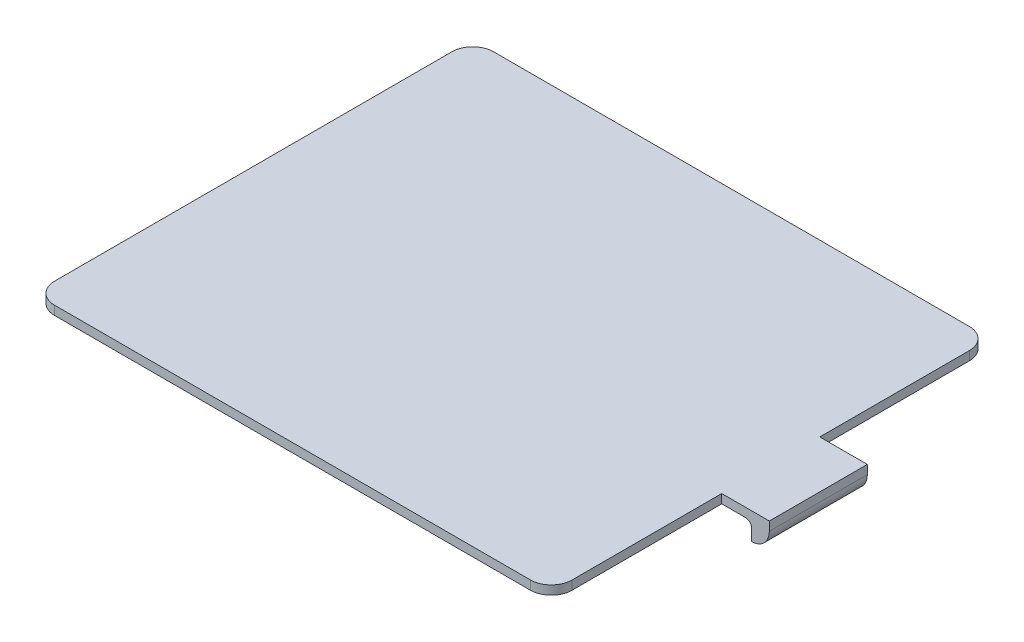
from build123d import *

# Parameters (mm, degrees)
BOSS_EXTRUDE1_DEPTH = 1.5
SKETCH3_W           = 16.488499631
SKETCH3_H           = 1.5
BOSS_EXTRUDE2_DEPTH = 8
SKETCH4_W           = 2.982324071
SKETCH4_H           = 16.488499631
REVOLVE1_ANGLE      = 90
FILLET1_R           = 1


with BuildPart() as part:
    # Sketch2 → Boss-Extrude1 (new body)
    with BuildSketch(Plane(origin=(0, -35, 0), x_dir=(1, 0, 0), z_dir=(0, 1, 0))):
        with BuildLine():
            Line((21.347125896, 31.053674712), (101.402209804, 31.053674712))
            ThreePointArc((101.402209804, 31.053674712), (103.877083539, 30.028548446), (104.902209804, 27.553674712))
            Line((104.902209804, 27.553674712), (104.902209804, -39.288548186))
            ThreePointArc((104.902209804, -39.288548186), (103.877083539, -41.76342192), (101.402209804, -42.788548186))
            Line((101.402209804, -42.788548186), (21.347125896, -42.788548186))
            ThreePointArc((21.347125896, -42.788548186), (18.872252162, -41.76342192), (17.847125896, -39.288548186))
            Line((17.847125896, -39.288548186), (17.847125896, 27.553674712))
            ThreePointArc((17.847125896, 27.553674712), (18.872252162, 30.028548446), (21.347125896, 31.053674712))
        make_face()
    extrude(amount=-BOSS_EXTRUDE1_DEPTH)

    # Sketch3 → Boss-Extrude2 (add)
    with BuildSketch(Plane(origin=(104.902209804, 0, 0), x_dir=(0, 0, -1), z_dir=(1, 0, 0))):
        with Locations((-5.867436738, -35.75)):
            Rectangle(SKETCH3_W, SKETCH3_H)
    extrude(amount=BOSS_EXTRUDE2_DEPTH)

    # Sketch4 → Revolve1 (revolve)
    with BuildSketch(Plane(origin=(0, -36.5, 0), x_dir=(-1, 0, 0), z_dir=(0, -1, 0))):
        with Locations((-111.411047768, -5.867436738)):
            Rectangle(SKETCH4_W, SKETCH4_H)
    revolve(axis=Axis((109.919885733, -36.5, 14.111686553), (0, 0, -1)), revolution_arc=REVOLVE1_ANGLE)

    # Fillet1
    fillet1_edges = [part.edges().sort_by_distance(p)[0] for p in [
        (109.919885733, -36.5, 5.867436737),
    ]]
    fillet(fillet1_edges, radius=FILLET1_R)


solid = part.part
